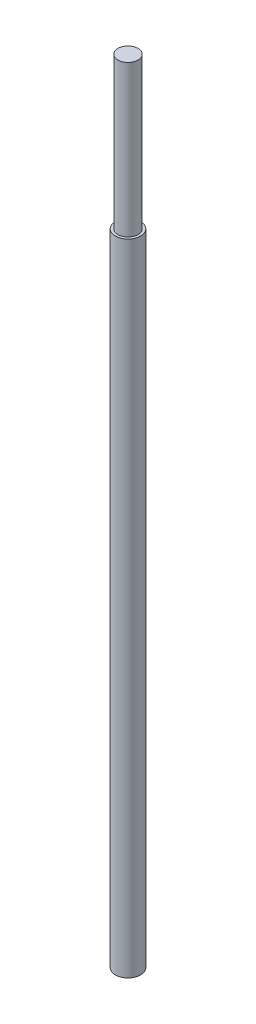
from build123d import *

# Parameters (mm, degrees)
SKETCH1_R           = 5
BOSS_EXTRUDE1_DEPTH = 254
SKETCH2_R           = 4
BOSS_EXTRUDE2_DEPTH = 60


with BuildPart() as part:
    # Sketch1 → Boss-Extrude1 (new body)
    with BuildSketch(Plane(origin=(0, 0, 0), x_dir=(1, 0, 0), z_dir=(0, 1, 0))):
        with Locations(Location((0, 0, 0), (0, 0, 270))):
            Circle(SKETCH1_R)
    extrude(amount=BOSS_EXTRUDE1_DEPTH)

    # Sketch2 → Boss-Extrude2 (add)
    with BuildSketch(Plane(origin=(0, 254, 0), x_dir=(1, 0, 0), z_dir=(0, 1, 0))):
        with Locations(Location((0, 0, 0), (0, 0, 270))):
            Circle(SKETCH2_R)
    extrude(amount=BOSS_EXTRUDE2_DEPTH)


solid = part.part
